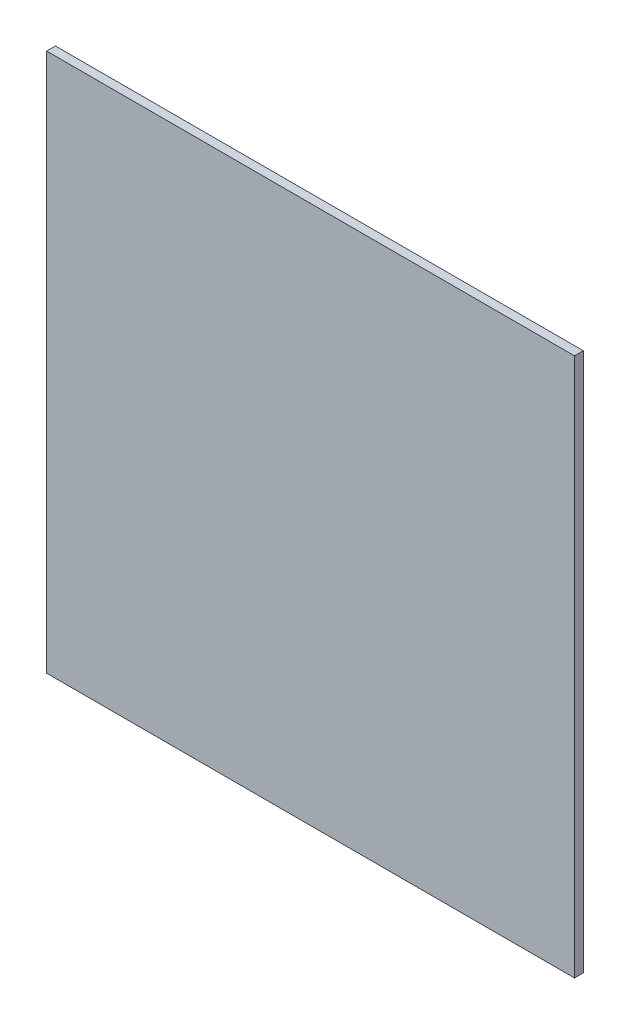
from build123d import *

# Parameters (mm, degrees)
SKETCH1_W           = 480
SKETCH1_H           = 490
BOSS_EXTRUDE1_DEPTH = 8


with BuildPart() as part:
    # Sketch1 → Boss-Extrude1 (new body)
    with BuildSketch(Plane.XY):
        Rectangle(SKETCH1_W, SKETCH1_H)
    extrude(amount=BOSS_EXTRUDE1_DEPTH)


solid = part.part
